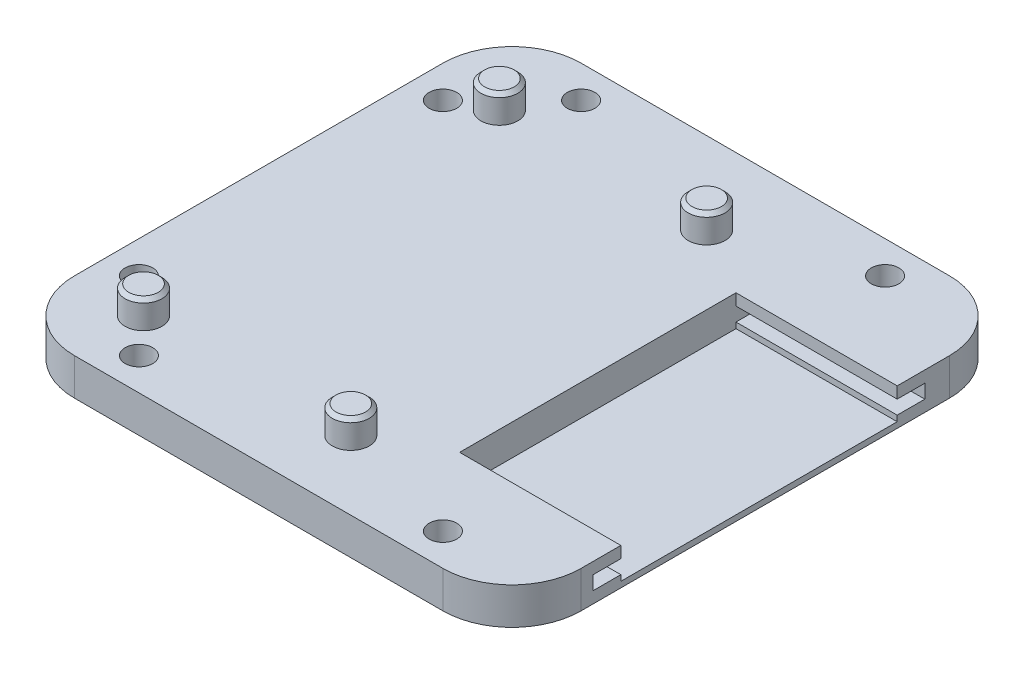
from build123d import *

# Parameters (mm, degrees)
SKETCH1_R                = 3
BOSS_EXTRUDE1_DEPTH      = 8
CUT_EXTRUDE1_DEPTH       = 35
SKETCH4_R                = 4
BOSS_EXTRUDE2_DEPTH      = 6
CHAMFER1_SIZE            = 0.8
CHAMFER1_OF_MIRROR1_SIZE = 0.8


with BuildPart() as part:
    # Sketch1 → Boss-Extrude1 (new body)
    with BuildSketch(Plane(origin=(0, 0, 0), x_dir=(1, 0, 0), z_dir=(0, 1, 0))):
        with BuildLine():
            Line((39.626089151, 56.371006445), (-40.373910849, 56.371006445))
            ThreePointArc((-40.373910849, 56.371006445), (-50.980512566, 51.977608163), (-55.373910849, 41.371006445))
            Line((-55.373910849, 41.371006445), (-55.373910849, -38.628993555))
            ThreePointArc((-55.373910849, -38.628993555), (-50.980512566, -49.235595273), (-40.373910849, -53.628993555))
            Line((-40.373910849, -53.628993555), (39.626089151, -53.628993555))
            ThreePointArc((39.626089151, -53.628993555), (50.232690869, -49.235595273), (54.626089151, -38.628993555))
            Line((54.626089151, -38.628993555), (54.626089151, 41.371006445))
            ThreePointArc((54.626089151, 41.371006445), (50.232690869, 51.977608163), (39.626089151, 56.371006445))
        make_face()
        with Locations(Location((-48.373910849, 34.371006445, 0), (0, 0, 270))):
            Circle(SKETCH1_R, mode=Mode.SUBTRACT)
        with Locations(Location((-33.373910849, 49.371006445, 0), (0, 0, 270))):
            Circle(SKETCH1_R, mode=Mode.SUBTRACT)
        with Locations(Location((32.626089151, 49.371006445, 0), (0, 0, 270))):
            Circle(SKETCH1_R, mode=Mode.SUBTRACT)
        with Locations(Location((-48.373910849, -31.628993555, 0), (0, 0, 270))):
            Circle(SKETCH1_R, mode=Mode.SUBTRACT)
        with Locations(Location((-33.373910849, -46.628993555, 0), (0, 0, 270))):
            Circle(SKETCH1_R, mode=Mode.SUBTRACT)
        with Locations(Location((32.626089151, -46.628993555, 0), (0, 0, 270))):
            Circle(SKETCH1_R, mode=Mode.SUBTRACT)
    extrude(amount=BOSS_EXTRUDE1_DEPTH)

    # Sketch3 → Cut-Extrude1 (cut)
    with BuildSketch(Plane(origin=(54.626089151, 0, 0), x_dir=(0, 0, -1), z_dir=(1, 0, 0))):
        Polygon((-30, 8), (-30, 5.5), (-36, 5.5), (-36, 2.5), (-30, 2.5), (-30, 1.25), (30, 1.25), (30, 2.5), (36, 2.5), (36, 5.5), (30, 5.5), (30, 8), align=None)
    extrude(amount=-CUT_EXTRUDE1_DEPTH, mode=Mode.SUBTRACT)

    # Sketch4 → Boss-Extrude2 (add)
    with BuildSketch(Plane(origin=(0, 8, 0), x_dir=(1, 0, 0), z_dir=(0, 1, 0))):
        with Locations(Location((4.626089151, -38.628993555, 0), (0, 0, 270))):
            Circle(SKETCH4_R)
        with Locations(Location((-40.373910849, -38.628993555, 0), (0, 0, 270))):
            Circle(SKETCH4_R)
    boss_extrude2 = extrude(amount=BOSS_EXTRUDE2_DEPTH)

    # Chamfer1
    chamfer1_edges = [part.edges().sort_by_distance(p)[0] for p in [
        (4.626089151, 14, 34.628993555),
        (-40.373910849, 14, 34.628993555),
    ]]
    chamfer(chamfer1_edges, length=CHAMFER1_SIZE)

    # Mirror1: Boss-Extrude2 across plane
    add(boss_extrude2.mirror(Plane.XY))

    # Chamfer1 of Mirror1
    chamfer1_of_mirror1_edges = [part.edges().sort_by_distance(p)[0] for p in [
        (4.626089151, 14, -34.628993555),
        (-40.373910849, 14, -34.628993555),
    ]]
    chamfer(chamfer1_of_mirror1_edges, length=CHAMFER1_OF_MIRROR1_SIZE)


solid = part.part
